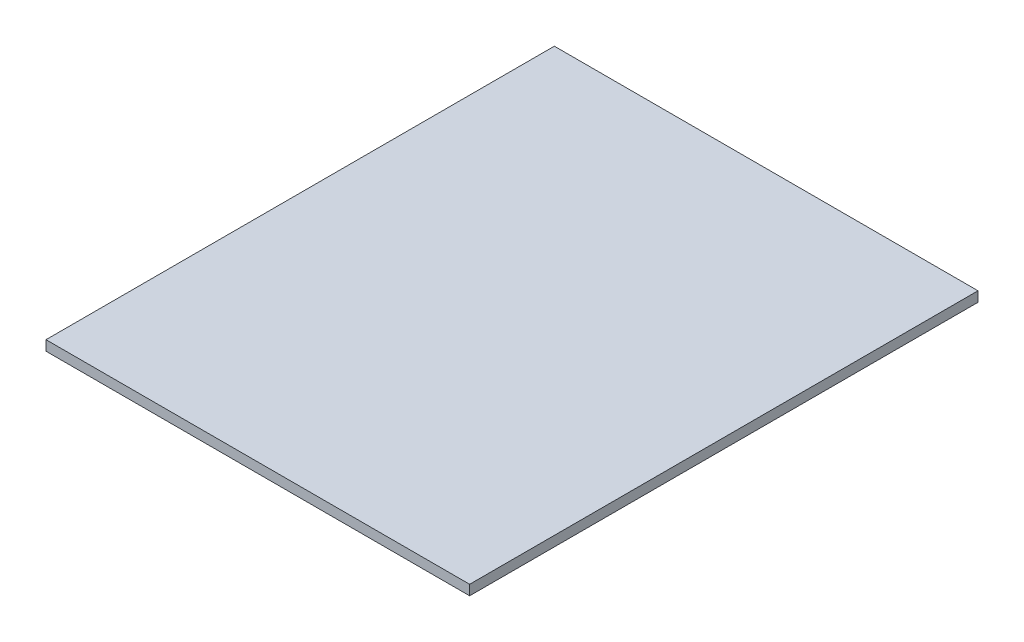
from build123d import *

# Parameters (mm, degrees)
SKETCH1_W           = 127
SKETCH1_H           = 152.4
BOSS_EXTRUDE1_DEPTH = 3


with BuildPart() as part:
    # Sketch1 → Boss-Extrude1 (new body)
    with BuildSketch(Plane(origin=(0, 0, 0), x_dir=(1, 0, 0), z_dir=(0, 1, 0))):
        Rectangle(SKETCH1_W, SKETCH1_H)
    extrude(amount=BOSS_EXTRUDE1_DEPTH)


solid = part.part
